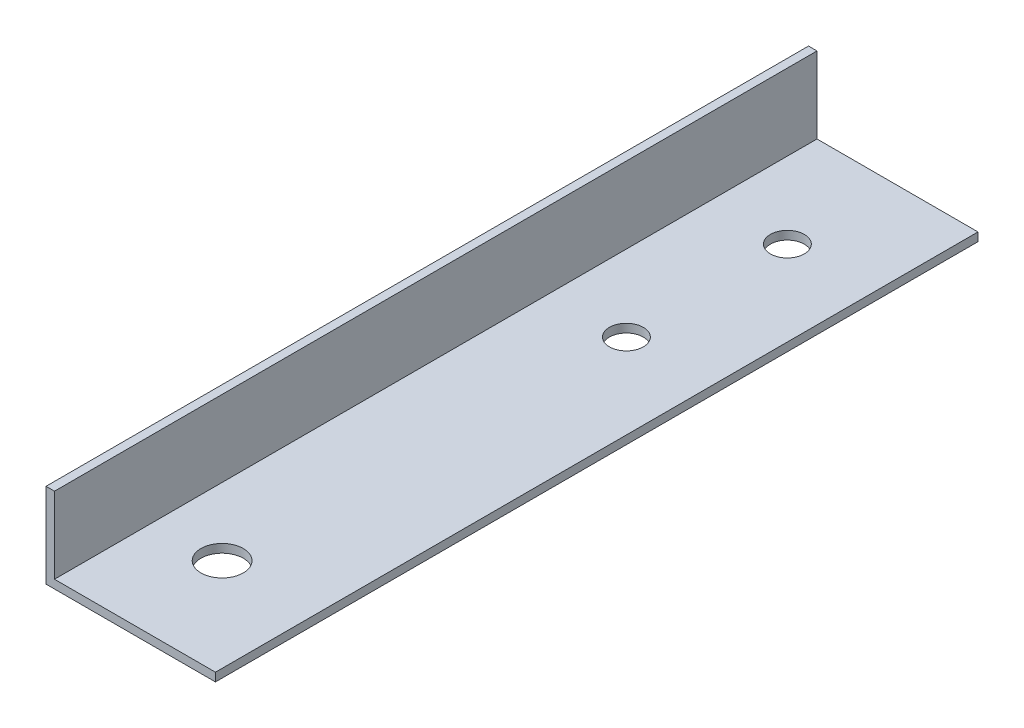
from build123d import *

# Parameters (mm, degrees)
BOSS_EXTRUDE1_DEPTH = 180
SKETCH3_R           = 4
SKETCH3_R_2         = 5
CUT_EXTRUDE1_DEPTH  = 10


with BuildPart() as part:
    # Sketch1 → Boss-Extrude1 (new body)
    with BuildSketch(Plane.XY):
        Polygon((-69.579831933, 29.327731092), (-67.579831933, 29.327731092), (-67.579831933, 11.327731092), (-29.579831933, 11.327731092), (-29.579831933, 9.327731092), (-69.579831933, 9.327731092), (-69.579831933, 11.327731092), align=None)
    extrude(amount=BOSS_EXTRUDE1_DEPTH)

    # Sketch3 → Cut-Extrude1 (cut)
    with BuildSketch(Plane.XZ.offset(-9.327731092)):
        with Locations(Location((-49.579831933, 63, 0), (0, 0, 270))):
            Circle(SKETCH3_R)
        with Locations(Location((-49.579831933, 25, 0), (0, 0, 270))):
            Circle(SKETCH3_R)
        with Locations(Location((-51.579831933, 156.42594511, 0), (0, 0, 270))):
            Circle(SKETCH3_R_2)
    extrude(amount=-CUT_EXTRUDE1_DEPTH, mode=Mode.SUBTRACT)


solid = part.part
